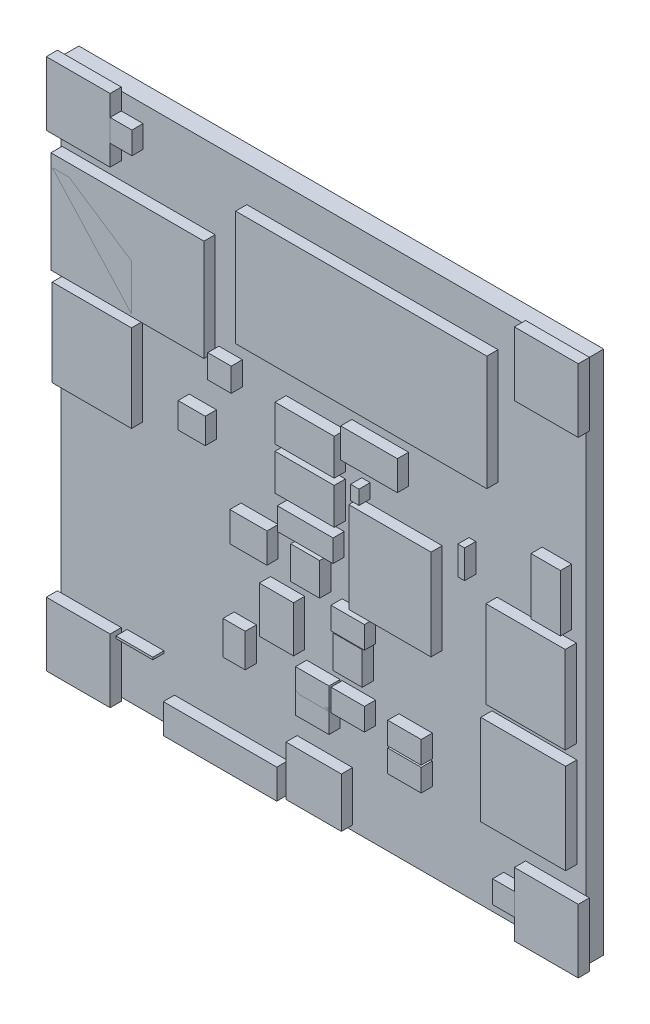
from build123d import *

# Parameters (mm, degrees)
SKETCH1_W                            = 46.99
SKETCH1_H                            = 46.99
BOARD_DEPTH                          = 1.6
SKETCH2_W                            = 3.327
SKETCH2_H                            = 2.6635
EXTRUDE_1210_1_DEPTH                 = 1
SKETCH3_W                            = 4.9968
SKETCH3_H                            = 1.9914
EXTRUDE_1206_1_DEPTH                 = 1
SKETCH4_W                            = 5.3016
SKETCH4_H                            = 3.2516
EIA3528_1_DEPTH                      = 1
SKETCH5_W                            = 5.3016
SKETCH5_H                            = 3.2516
EIA3528_2_DEPTH                      = 1
SKETCH6_W                            = 2.9968
SKETCH6_H                            = 1.9914
F_0603_CAP_1_DEPTH                   = 1
SKETCH7_W                            = 1.9914
SKETCH7_H                            = 2.9968
F_0603_CAP_2_DEPTH                   = 1
SKETCH8_W                            = 2.5908
SKETCH8_H                            = 2.921
SOT23_1_DEPTH                        = 1
SKETCH9_W                            = 2.5908
SKETCH9_H                            = 2.921
SOT23_2_DEPTH                        = 1
SKETCH10_W                           = 2
SKETCH10_H                           = 2
FIDUCIAL_1X2_1_DEPTH                 = 1
SKETCH11_W                           = 2
SKETCH11_H                           = 2
FIDUCIAL_1X2_2_DEPTH                 = 1
SKETCH14_W                           = 13.7016
SKETCH14_H                           = 9.1016
POWER_JACK_PTH_1_DEPTH               = 1
SKETCH15_W                           = 7.6016
SKETCH15_H                           = 8.1016
JST_2_SMD_1_DEPTH                    = 1
SKETCH16_W                           = 10.16
SKETCH16_H                           = 2.6416
EXTRUDE_1X04_1_DEPTH                 = 1
SKETCH17_W                           = 2.6416
SKETCH17_H                           = 5.08
EXTRUDE_1X02_1_DEPTH                 = 1
SKETCH18_W                           = 7.1016
SKETCH18_H                           = 7.8
SCREWTERMINAL_3_5MM_2_1_DEPTH        = 1
SKETCH19_W                           = 7.1016
SKETCH19_H                           = 7.8
SCREWTERMINAL_3_5MM_2_2_DEPTH        = 1
SKETCH20_W                           = 7.1016
SKETCH20_H                           = 7.8
SCREWTERMINAL_3_5MM_2_3_DEPTH        = 1
SKETCH21_W                           = 2.4384
SKETCH21_H                           = 2.286
SJ_2S_1_DEPTH                        = 1
SKETCH22_W                           = 2.1016
SKETCH22_H                           = 2.1115
SJ_2S_NO_1_DEPTH                     = 1
SKETCH23_W                           = 0.6096
SKETCH23_H                           = 2.54
PTH_JUMPER_NC_BOTTOM_NO_SILK_1_DEPTH = 1
SKETCH24_W                           = 5.08
SKETCH24_H                           = 2.6416
EXTRUDE_1X02_2_DEPTH                 = 1
SKETCH25_W                           = 7.3635
SKETCH25_H                           = 8.127
CR75_1_DEPTH                         = 1
SKETCH26_W                           = 22.49
SKETCH26_H                           = 10.28
SFE_LOGO_NAME_FLAME_2_1_DEPTH        = 1
SKETCH27_W                           = 4.9628
SKETCH27_H                           = 4.4514
OSHW_LOGO_M_1_DEPTH                  = 1
SKETCH28_W                           = 2.9776
SKETCH28_H                           = 2.6708
OSHW_LOGO_S_1_DEPTH                  = 1
SKETCH29_W                           = 33.25
SKETCH29_H                           = 15.42
SFE_LOGO_NAME_FLAME_3_1_DEPTH        = 1
SKETCH30_W                           = 0.7524
SKETCH30_H                           = 1.2762
EXTRUDE_0805_1_DEPTH                 = 1
SKETCH31_W                           = 2.9968
SKETCH31_H                           = 1.9914
F_0603_RES_1_DEPTH                   = 1
SKETCH32_W                           = 2.9968
SKETCH32_H                           = 1.9914
F_0603_RES_2_DEPTH                   = 1
SKETCH33_W                           = 2.9968
SKETCH33_H                           = 1.9914
F_0603_RES_3_DEPTH                   = 1
SKETCH34_W                           = 2.9968
SKETCH34_H                           = 1.9914
F_0603_RES_4_DEPTH                   = 1
SKETCH35_W                           = 2.9968
SKETCH35_H                           = 1.9914
F_0603_RES_5_DEPTH                   = 1
SKETCH36_W                           = 3.3016
SKETCH36_H                           = 0.2032
TRIMPOT_3MM_1_DEPTH                  = 1
SKETCH37_W                           = 5.715
SKETCH37_H                           = 5.715
STAND_OFF_1_DEPTH                    = 1
SKETCH38_W                           = 5.715
SKETCH38_H                           = 5.715
STAND_OFF_2_DEPTH                    = 1
SKETCH39_W                           = 5.715
SKETCH39_H                           = 5.715
STAND_OFF_3_DEPTH                    = 1
SKETCH40_W                           = 5.715
SKETCH40_H                           = 5.715
STAND_OFF_4_DEPTH                    = 1
SKETCH41_W                           = 3.0635
SKETCH41_H                           = 4.127
MSOP_12_GND_1_DEPTH                  = 1


with BuildPart() as part:
    # Sketch1 → BOARD (new body)
    with BuildSketch(Plane.XY):
        with Locations((23.495, 23.495)):
            Rectangle(SKETCH1_W, SKETCH1_H)
    extrude(amount=BOARD_DEPTH)


with BuildPart() as body_2:
    # Sketch2 → 1210-1 (new body)
    with BuildSketch(Plane.XY.offset(1.6)):
        with Locations((17.78, 19.08175)):
            Rectangle(SKETCH2_W, SKETCH2_H)
    extrude(amount=EXTRUDE_1210_1_DEPTH)


with BuildPart() as body_3:
    # Sketch3 → 1206-1 (new body)
    with BuildSketch(Plane.XY.offset(1.6)):
        with Locations((22.86, 21.8313)):
            Rectangle(SKETCH3_W, SKETCH3_H)
    extrude(amount=EXTRUDE_1206_1_DEPTH)


with BuildPart() as body_4:
    # Sketch4 → EIA3528-1 (new body)
    with BuildSketch(Plane.XY.offset(1.6)):
        with Locations((22.8092, 29.1342)):
            Rectangle(SKETCH4_W, SKETCH4_H)
    extrude(amount=EIA3528_1_DEPTH)


with BuildPart() as body_5:
    # Sketch5 → EIA3528-2 (new body)
    with BuildSketch(Plane.XY.offset(1.6)):
        with Locations((22.8092, 25.3242)):
            Rectangle(SKETCH5_W, SKETCH5_H)
    extrude(amount=EIA3528_2_DEPTH)


with BuildPart() as body_6:
    # Sketch6 → 0603-CAP-1 (new body)
    with BuildSketch(Plane.XY.offset(1.6)):
        with Locations((26.67, 16.5227)):
            Rectangle(SKETCH6_W, SKETCH6_H)
    extrude(amount=F_0603_CAP_1_DEPTH)


with BuildPart() as body_7:
    # Sketch7 → 0603-CAP-2 (new body)
    with BuildSketch(Plane.XY.offset(1.6)):
        with Locations((16.4973, 10.16)):
            Rectangle(SKETCH7_W, SKETCH7_H)
    extrude(amount=F_0603_CAP_2_DEPTH)


with BuildPart() as body_8:
    # Sketch8 → SOT23-1 (new body)
    with BuildSketch(Plane.XY.offset(1.6)):
        with Locations((22.86, 19.0119)):
            Rectangle(SKETCH8_W, SKETCH8_H)
    extrude(amount=SOT23_1_DEPTH)


with BuildPart() as body_9:
    # Sketch9 → SOT23-2 (new body)
    with BuildSketch(Plane.XY.offset(1.6)):
        with Locations((26.67, 14.0081)):
            Rectangle(SKETCH9_W, SKETCH9_H)
    extrude(amount=SOT23_2_DEPTH)


with BuildPart() as body_10:
    # Sketch10 → FIDUCIAL-1X2-1 (new body)
    with BuildSketch(Plane.XY.offset(1.6)):
        with Locations((6.35, 44.45)):
            Rectangle(SKETCH10_W, SKETCH10_H)
    extrude(amount=FIDUCIAL_1X2_1_DEPTH)


with BuildPart() as body_11:
    # Sketch11 → FIDUCIAL-1X2-2 (new body)
    with BuildSketch(Plane.XY.offset(1.6)):
        with Locations((40.64, 2.54)):
            Rectangle(SKETCH11_W, SKETCH11_H)
    extrude(amount=FIDUCIAL_1X2_2_DEPTH)


with BuildPart() as body_12:
    # Sketch14 → POWER_JACK_PTH-1 (new body)
    with BuildSketch(Plane.XY.offset(1.6)):
        with Locations((6.9508, 35.5092)):
            Rectangle(SKETCH14_W, SKETCH14_H)
    extrude(amount=POWER_JACK_PTH_1_DEPTH)


with BuildPart() as body_13:
    # Sketch15 → JST-2-SMD-1 (new body)
    with BuildSketch(Plane.XY.offset(1.6)):
        with Locations((42.3792, 11.4808)):
            Rectangle(SKETCH15_W, SKETCH15_H)
    extrude(amount=JST_2_SMD_1_DEPTH)


with BuildPart() as body_14:
    # Sketch16 → 1X04-1 (new body)
    with BuildSketch(Plane.XY.offset(1.6)):
        with Locations((15.24, 1.2192)):
            Rectangle(SKETCH16_W, SKETCH16_H)
    extrude(amount=EXTRUDE_1X04_1_DEPTH)


with BuildPart() as body_15:
    # Sketch17 → 1X02-1 (new body)
    with BuildSketch(Plane.XY.offset(1.6)):
        with Locations((44.3992, 27.94)):
            Rectangle(SKETCH17_W, SKETCH17_H)
    extrude(amount=EXTRUDE_1X02_1_DEPTH)


with BuildPart() as body_16:
    # Sketch18 → SCREWTERMINAL-3_5MM-2-1 (new body)
    with BuildSketch(Plane.XY.offset(1.6)):
        with Locations((42.5942, 20.673)):
            Rectangle(SKETCH18_W, SKETCH18_H)
    extrude(amount=SCREWTERMINAL_3_5MM_2_1_DEPTH)


with BuildPart() as body_17:
    # Sketch19 → SCREWTERMINAL-3_5MM-2-2 (new body)
    with BuildSketch(Plane.XY.offset(1.6)):
        with Locations((3.7608, 35.08)):
            Rectangle(SKETCH19_W, SKETCH19_H)
    extrude(amount=SCREWTERMINAL_3_5MM_2_2_DEPTH)


with BuildPart() as body_18:
    # Sketch20 → SCREWTERMINAL-3_5MM-2-3 (new body)
    with BuildSketch(Plane.XY.offset(1.6)):
        with Locations((3.7608, 26.19)):
            Rectangle(SKETCH20_W, SKETCH20_H)
    extrude(amount=SCREWTERMINAL_3_5MM_2_3_DEPTH)


with BuildPart() as body_19:
    # Sketch21 → SJ_2S-1 (new body)
    with BuildSketch(Plane.XY.offset(1.6)):
        with Locations((12.7, 25.4)):
            Rectangle(SKETCH21_W, SKETCH21_H)
    extrude(amount=SJ_2S_1_DEPTH)


with BuildPart() as body_20:
    # Sketch22 → SJ_2S-NO-1 (new body)
    with BuildSketch(Plane.XY.offset(1.6)):
        with Locations((15.1892, 30.5308)):
            Rectangle(SKETCH22_W, SKETCH22_H)
    extrude(amount=SJ_2S_NO_1_DEPTH)


with BuildPart() as body_21:
    # Sketch23 → PTH-JUMPER-NC_BOTTOM_NO_SILK-1 (new body)
    with BuildSketch(Plane.XY.offset(1.6)):
        with Locations((36.83, 26.67)):
            Rectangle(SKETCH23_W, SKETCH23_H)
    extrude(amount=PTH_JUMPER_NC_BOTTOM_NO_SILK_1_DEPTH)


with BuildPart() as body_22:
    # Sketch24 → 1X02-2 (new body)
    with BuildSketch(Plane.XY.offset(1.6)):
        with Locations((28.575, 30.5308)):
            Rectangle(SKETCH24_W, SKETCH24_H)
    extrude(amount=EXTRUDE_1X02_2_DEPTH)


with BuildPart() as body_23:
    # Sketch25 → CR75-1 (new body)
    with BuildSketch(Plane.XY.offset(1.6)):
        with Locations((30.44825, 22.05)):
            Rectangle(SKETCH25_W, SKETCH25_H)
    extrude(amount=CR75_1_DEPTH)


with BuildPart() as body_24:
    # Sketch26 → SFE_LOGO_NAME_FLAME__2-1 (new body)
    with BuildSketch(Plane.XY.offset(1.6)):
        with Locations((27.882, 38.668)):
            Rectangle(SKETCH26_W, SKETCH26_H)
    extrude(amount=SFE_LOGO_NAME_FLAME_2_1_DEPTH)


with BuildPart() as body_25:
    # Sketch27 → OSHW-LOGO-M-1 (new body)
    with BuildSketch(Plane.XY.offset(1.6)):
        with Locations((23.622, 2.6687)):
            Rectangle(SKETCH27_W, SKETCH27_H)
    extrude(amount=OSHW_LOGO_M_1_DEPTH)


with BuildPart() as body_26:
    # Sketch28 → OSHW-LOGO-S-1 (new body)
    with BuildSketch(Plane.XY):
        with Locations((2.54, 7.7734)):
            Rectangle(SKETCH28_W, SKETCH28_H)
    extrude(amount=-OSHW_LOGO_S_1_DEPTH)


with BuildPart() as body_27:
    # Sketch29 → SFE_LOGO_NAME_FLAME__3-1 (new body)
    with BuildSketch(Plane.XY):
        with Locations((24.015, 22.95)):
            Rectangle(SKETCH29_W, SKETCH29_H)
    extrude(amount=-SFE_LOGO_NAME_FLAME_3_1_DEPTH)


with BuildPart() as body_28:
    # Sketch30 → 0805-1 (new body)
    with BuildSketch(Plane.XY.offset(1.6)):
        with Locations((27.305, 27.1399)):
            Rectangle(SKETCH30_W, SKETCH30_H)
    extrude(amount=EXTRUDE_0805_1_DEPTH)


with BuildPart() as body_29:
    # Sketch31 → 0603-RES-1 (new body)
    with BuildSketch(Plane.XY.offset(1.6)):
        with Locations((26.67, 10.1727)):
            Rectangle(SKETCH31_W, SKETCH31_H)
    extrude(amount=F_0603_RES_1_DEPTH)


with BuildPart() as body_30:
    # Sketch32 → 0603-RES-2 (new body)
    with BuildSketch(Plane.XY.offset(1.6)):
        with Locations((23.495, 8.3947)):
            Rectangle(SKETCH32_W, SKETCH32_H)
    extrude(amount=F_0603_RES_2_DEPTH)


with BuildPart() as body_31:
    # Sketch33 → 0603-RES-3 (new body)
    with BuildSketch(Plane.XY.offset(1.6)):
        with Locations((23.495, 10.1727)):
            Rectangle(SKETCH33_W, SKETCH33_H)
    extrude(amount=F_0603_RES_3_DEPTH)


with BuildPart() as body_32:
    # Sketch34 → 0603-RES-4 (new body)
    with BuildSketch(Plane.XY.offset(1.6)):
        with Locations((31.75, 10.1473)):
            Rectangle(SKETCH34_W, SKETCH34_H)
    extrude(amount=F_0603_RES_4_DEPTH)


with BuildPart() as body_33:
    # Sketch35 → 0603-RES-5 (new body)
    with BuildSketch(Plane.XY.offset(1.6)):
        with Locations((31.75, 7.9883)):
            Rectangle(SKETCH35_W, SKETCH35_H)
    extrude(amount=F_0603_RES_5_DEPTH)


with BuildPart() as body_34:
    # Sketch36 → TRIMPOT-3MM-1 (new body)
    with BuildSketch(Plane.XY.offset(1.6)):
        with Locations((7.5692, 5.41)):
            Rectangle(SKETCH36_W, SKETCH36_H)
    extrude(amount=TRIMPOT_3MM_1_DEPTH)


with BuildPart() as body_35:
    # Sketch37 → STAND-OFF-1 (new body)
    with BuildSketch(Plane.XY.offset(1.6)):
        with Locations((2.54, 2.54)):
            Rectangle(SKETCH37_W, SKETCH37_H)
    extrude(amount=STAND_OFF_1_DEPTH)


with BuildPart() as body_36:
    # Sketch38 → STAND-OFF-2 (new body)
    with BuildSketch(Plane.XY.offset(1.6)):
        with Locations((2.54, 44.45)):
            Rectangle(SKETCH38_W, SKETCH38_H)
    extrude(amount=STAND_OFF_2_DEPTH)


with BuildPart() as body_37:
    # Sketch39 → STAND-OFF-3 (new body)
    with BuildSketch(Plane.XY.offset(1.6)):
        with Locations((44.45, 44.45)):
            Rectangle(SKETCH39_W, SKETCH39_H)
    extrude(amount=STAND_OFF_3_DEPTH)


with BuildPart() as body_38:
    # Sketch40 → STAND-OFF-4 (new body)
    with BuildSketch(Plane.XY.offset(1.6)):
        with Locations((44.45, 2.54)):
            Rectangle(SKETCH40_W, SKETCH40_H)
    extrude(amount=STAND_OFF_4_DEPTH)


with BuildPart() as body_39:
    # Sketch41 → MSOP-12_GND-1 (new body)
    with BuildSketch(Plane.XY.offset(1.6)):
        with Locations((20.28825, 13.97)):
            Rectangle(SKETCH41_W, SKETCH41_H)
    extrude(amount=MSOP_12_GND_1_DEPTH)


solid = Compound([part.part, body_2.part, body_3.part, body_4.part, body_5.part, body_6.part, body_7.part, body_8.part, body_9.part, body_10.part, body_11.part, body_12.part, body_13.part, body_14.part, body_15.part, body_16.part, body_17.part, body_18.part, body_19.part, body_20.part, body_21.part, body_22.part, body_23.part, body_24.part, body_25.part, body_26.part, body_27.part, body_28.part, body_29.part, body_30.part, body_31.part, body_32.part, body_33.part, body_34.part, body_35.part, body_36.part, body_37.part, body_38.part, body_39.part])
